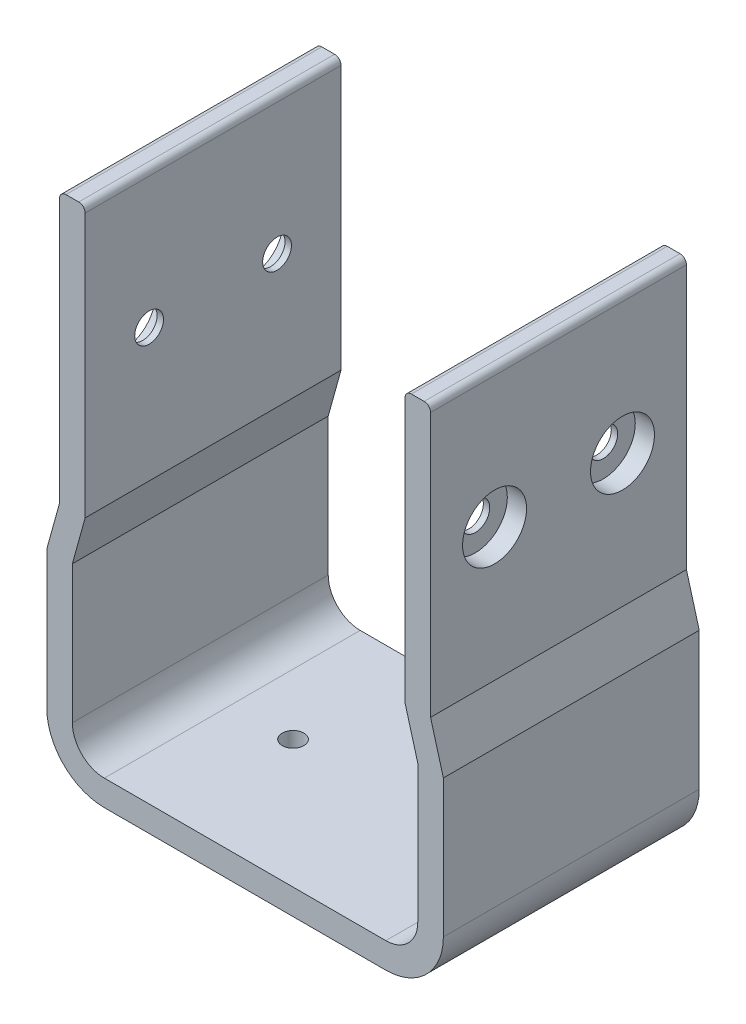
from build123d import *

# Parameters (mm, degrees)
ESTRUSIONE_ESTRUSIONE1_DEPTH                         = 40
RACCORDO1_R                                          = 1
FORO_LAMATO_PER_BULLONE_M12_A_TESTA_ESAG_D           = 4.5
FORO_LAMATO_PER_BULLONE_M12_A_TESTA_ESAG_DEPTH       = 8.5
FORO_LAMATO_PER_BULLONE_M12_A_TESTA_ESAG_CBORE_D     = 10
FORO_LAMATO_PER_BULLONE_M12_A_TESTA_ESAG_CBORE_DEPTH = 3
FORO_LAMATO_PER_BULLONE_M12_A_TESTA_ESAG_TIP         = 1.351936393
FORO_LAMATO_PER_BULLONE_M12_A_TESTA_2_D              = 4.5
FORO_LAMATO_PER_BULLONE_M12_A_TESTA_2_DEPTH          = 8.5
FORO_LAMATO_PER_BULLONE_M12_A_TESTA_2_CBORE_D        = 10
FORO_LAMATO_PER_BULLONE_M12_A_TESTA_2_CBORE_DEPTH    = 3
FORO_LAMATO_PER_BULLONE_M12_A_TESTA_2_TIP            = 1.351936393
FORO_PER_VITE_M3_1_D                                 = 3.4
FORO_PER_VITE_M3_1_DEPTH                             = 8.5
FORO_PER_VITE_M3_1_TIP                               = 1.021463052


with BuildPart() as part:
    # Schizzo1 → Estrusione-Estrusione1 (new body)
    with BuildSketch(Plane.XY):
        with BuildLine():
            Line((9, 0), (53, 0))
            ThreePointArc((53, 0), (59.363961031, 2.636038969), (62, 9))
            Line((62, 9), (62, 30.52))
            Line((62, 30.52), (60, 37.73))
            Line((60, 37.73), (60, 80))
            Line((60, 80), (56, 80))
            Line((56, 80), (56, 37.73))
            Line((56, 37.73), (58, 30.52))
            Line((58, 30.52), (58, 9))
            ThreePointArc((58, 9), (56.535533906, 5.464466094), (53, 4))
            Line((53, 4), (9, 4))
            ThreePointArc((9, 4), (5.464466094, 5.464466094), (4, 9))
            Line((4, 9), (4, 30.52))
            Line((4, 30.52), (6, 37.73))
            Line((6, 37.73), (6, 80))
            Line((6, 80), (2, 80))
            Line((2, 80), (2, 37.73))
            Line((2, 37.73), (0, 30.52))
            Line((0, 30.52), (0, 9))
            ThreePointArc((0, 9), (2.636038969, 2.636038969), (9, 0))
        make_face()
    extrude(amount=ESTRUSIONE_ESTRUSIONE1_DEPTH)

    # Raccordo1
    raccordo1_edges = [part.edges().sort_by_distance(p)[0] for p in [
        (2, 80, 20),
        (6, 80, 20),
        (56, 80, 20),
        (60, 80, 20),
    ]]
    fillet(raccordo1_edges, radius=RACCORDO1_R)

    # Foro lamato per Bullone M12 a testa esag
    with Locations(Plane.ZY.offset(-2)):
        with Locations((10, 58.5), (30, 58.5)):
            CounterBoreHole(FORO_LAMATO_PER_BULLONE_M12_A_TESTA_ESAG_D / 2, FORO_LAMATO_PER_BULLONE_M12_A_TESTA_ESAG_CBORE_D / 2, FORO_LAMATO_PER_BULLONE_M12_A_TESTA_ESAG_CBORE_DEPTH, depth=FORO_LAMATO_PER_BULLONE_M12_A_TESTA_ESAG_DEPTH)
            with Locations((0, 0, -(FORO_LAMATO_PER_BULLONE_M12_A_TESTA_ESAG_DEPTH + FORO_LAMATO_PER_BULLONE_M12_A_TESTA_ESAG_TIP / 2))):  # 118° drill point
                Cone(0, FORO_LAMATO_PER_BULLONE_M12_A_TESTA_ESAG_D / 2, FORO_LAMATO_PER_BULLONE_M12_A_TESTA_ESAG_TIP, mode=Mode.SUBTRACT)

    # Foro lamato per Bullone M12 a testa  2
    with Locations(Plane(origin=(60, 0, 0), x_dir=(0, 0, -1), z_dir=(1, 0, 0))):
        with Locations((-30, 58.5), (-10, 58.5)):
            CounterBoreHole(FORO_LAMATO_PER_BULLONE_M12_A_TESTA_2_D / 2, FORO_LAMATO_PER_BULLONE_M12_A_TESTA_2_CBORE_D / 2, FORO_LAMATO_PER_BULLONE_M12_A_TESTA_2_CBORE_DEPTH, depth=FORO_LAMATO_PER_BULLONE_M12_A_TESTA_2_DEPTH)
            with Locations((0, 0, -(FORO_LAMATO_PER_BULLONE_M12_A_TESTA_2_DEPTH + FORO_LAMATO_PER_BULLONE_M12_A_TESTA_2_TIP / 2))):  # 118° drill point
                Cone(0, FORO_LAMATO_PER_BULLONE_M12_A_TESTA_2_D / 2, FORO_LAMATO_PER_BULLONE_M12_A_TESTA_2_TIP, mode=Mode.SUBTRACT)

    # Foro per Vite M3-1
    with Locations(Plane(origin=(0, 4, 0), x_dir=(1, 0, 0), z_dir=(0, 1, 0))):
        with Locations((18.5, -20), (43.5, -20)):
            Hole(FORO_PER_VITE_M3_1_D / 2, depth=FORO_PER_VITE_M3_1_DEPTH)
            with Locations((0, 0, -(FORO_PER_VITE_M3_1_DEPTH + FORO_PER_VITE_M3_1_TIP / 2))):  # 118° drill point
                Cone(0, FORO_PER_VITE_M3_1_D / 2, FORO_PER_VITE_M3_1_TIP, mode=Mode.SUBTRACT)


solid = part.part
